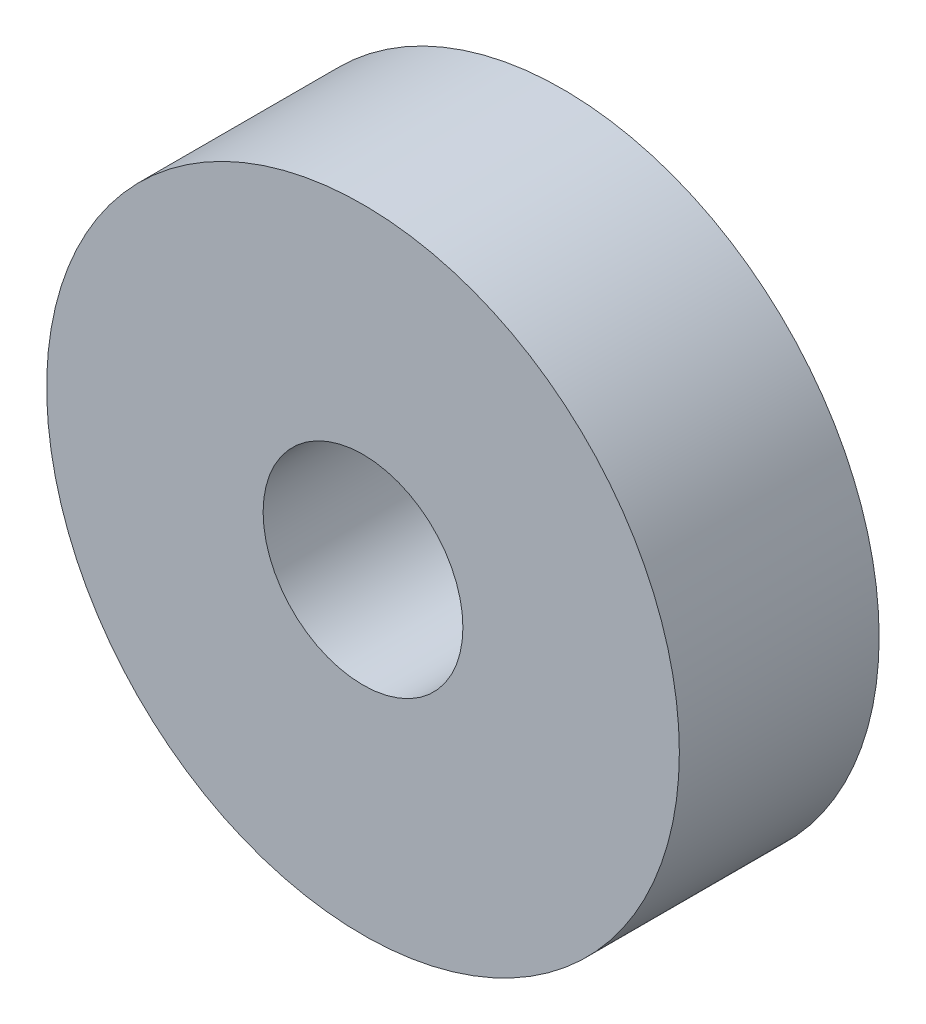
from build123d import *

# Parameters (mm, degrees)
SKETCH_1_W = 6.5
SKETCH_1_H = 6
SKETCH_1_R = 1.5


with BuildPart() as part:
    # Эскиз1 → Повернуть1 (revolve)
    with BuildSketch(Plane(origin=(0, 0, 0), x_dir=(1, 0, 0), z_dir=(0, 1, 0)), mode=Mode.PRIVATE) as revolve_1_sk:
        with Locations((-6.25, 3)):
            Rectangle(SKETCH_1_W, SKETCH_1_H)
        with Locations((-5.75, 3)):
            Circle(SKETCH_1_R, mode=Mode.SUBTRACT)
    revolve(revolve_1_sk.sketch.rotate(Axis((0, 0, 0), (0, 0, -1)), 180), axis=Axis((0, 0, 0), (0, 0, -1)))


solid = part.part
